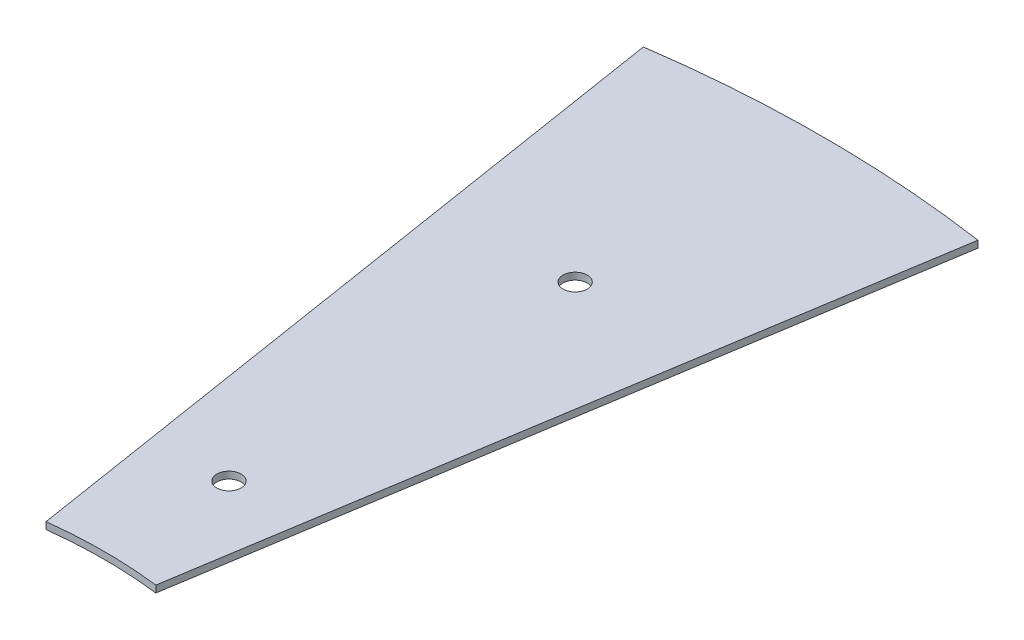
from build123d import *

# Parameters (mm, degrees)
BOSS_EXTRUDE1_DEPTH = 1
SKETCH3_R           = 1.755
CUT_EXTRUDE2_DEPTH  = 171.729965471


with BuildPart() as part:
    # Sketch1 → Boss-Extrude1 (new body)
    with BuildSketch(Plane(origin=(0, 0, 0), x_dir=(1, 0, 0), z_dir=(0, 1, 0))):
        with BuildLine():
            Line((-24.22232668, 167.255131133), (-7.949423814, 64.512066011))
            ThreePointArc((-7.949423814, 64.512066011), (0, 65), (7.949423814, 64.512066011))
            Line((7.949423814, 64.512066011), (24.22232668, 167.255131133))
            ThreePointArc((24.22232668, 167.255131133), (0, 169), (-24.22232668, 167.255131133))
        make_face()
    extrude(amount=BOSS_EXTRUDE1_DEPTH)

    # Sketch3 → Cut-Extrude2 (cut, through all)
    with BuildSketch(Plane.XZ):
        with Locations(Location((0.196844211, -82.845225749, 0), (0, 0, 270))):
            Circle(SKETCH3_R)
        with Locations(Location((0.315646263, -132.845084609, 0), (0, 0, 270))):
            Circle(SKETCH3_R)
    extrude(amount=-CUT_EXTRUDE2_DEPTH, mode=Mode.SUBTRACT)


solid = part.part
